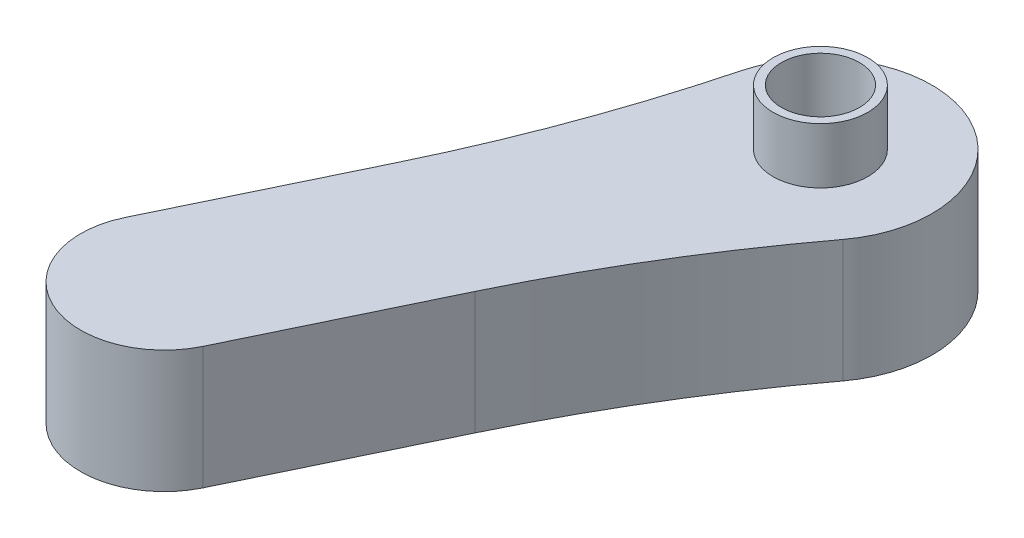
from build123d import *
from build123d.topology import SkipClean

# Parameters (mm, degrees)
EXTRUDE_1_DEPTH     = 4
SKETCH_4_R          = 17
SKETCH_4_R_2        = 14
EXTRUDE_2_DEPTH     = 20
SKETCH_5_R          = 1.75
CUT_EXTRUDE_1_DEPTH = 20
SKETCH_6_R          = 2.4
CUT_EXTRUDE_2_DEPTH = 3
EXTRUDE_START       = 40
EXTRUDE_5_DEPTH     = 40
SKETCH_12_R         = 2.4
CUT_EXTRUDE_3_DEPTH = 3


with BuildPart() as part:
    # 草图1 → 凸台-拉伸1 (new body)
    with BuildSketch(Plane(origin=(0, 0, 0), x_dir=(1, 0, 0), z_dir=(0, 1, 0))):
        with BuildLine():
            Line((-71.917570517, -80.173954941), (-103.604258307, -145.956882654))
            ThreePointArc((-103.604258307, -145.956882654), (-89.595311386, -186.003722806), (-49.548471234, -171.994775885))
            Line((-49.548471234, -171.994775885), (-17.861783444, -106.211848172))
            ThreePointArc((-17.861783444, -106.211848172), (5.107697531, -63.872728225), (32.044674728, -23.940317909))
            ThreePointArc((32.044674728, -23.940317909), (17.358595487, 36.037191382), (-38.694997244, 10.133962122))
            ThreePointArc((-38.694997244, 10.133962122), (-53.128760753, -35.82106595), (-71.917570517, -80.173954941))
        make_face()
    extrude(amount=EXTRUDE_1_DEPTH)

    # 草图4 → 凸台-拉伸2 (add)
    with BuildSketch(Plane(origin=(0, 4, 0), x_dir=(1, 0, 0), z_dir=(0, 1, 0))):
        with Locations(Location((0, 0, 0), (0, 0, 270))):
            Circle(SKETCH_4_R)
        with Locations(Location((0, 0, 0), (0, 0, 270))):
            Circle(SKETCH_4_R_2, mode=Mode.SUBTRACT)
    extrude(amount=EXTRUDE_2_DEPTH)

    # 草图5 → 切除-拉伸1 (cut)
    with BuildSketch(Plane(origin=(0, 4, 0), x_dir=(1, 0, 0), z_dir=(0, 1, 0))):
        with Locations(Location((3.471719097, 7.207438276, 0), (0, 0, 270))):
            Circle(SKETCH_5_R)
        with Locations(Location((7.207438276, -3.471719097, 0), (0, 0, 270))):
            Circle(SKETCH_5_R)
        with Locations(Location((-3.471719097, -7.207438276, 0), (0, 0, 270))):
            Circle(SKETCH_5_R)
        with Locations(Location((-7.207438276, 3.471719097, 0), (0, 0, 270))):
            Circle(SKETCH_5_R)
    extrude(amount=-CUT_EXTRUDE_1_DEPTH, mode=Mode.SUBTRACT)

    # 草图6 → 切除-拉伸2 (cut)
    with BuildSketch(Plane.XZ):
        with Locations(Location((-3.471719097, 7.207438276, 0), (0, 0, 270))):
            Circle(SKETCH_6_R)
        with Locations(Location((7.207438276, 3.471719097, 0), (0, 0, 270))):
            Circle(SKETCH_6_R)
        with Locations(Location((3.471719097, -7.207438276, 0), (0, 0, 270))):
            Circle(SKETCH_6_R)
        with Locations(Location((-7.207438276, -3.471719097, 0), (0, 0, 270))):
            Circle(SKETCH_6_R)
    extrude(amount=-CUT_EXTRUDE_2_DEPTH, mode=Mode.SUBTRACT)

    # 草图11 → 凸台-拉伸5 (add)
    with SkipClean():  # the faces are left unmerged after this step: merging them gives an invalid solid
        with BuildSketch(Plane.XZ.offset(EXTRUDE_START)):
            with BuildLine():
                Line((-103.604258307, 145.956882654), (-71.917570517, 80.173954941))
                ThreePointArc((-71.917570517, 80.173954941), (-53.128760753, 35.82106595), (-38.694997244, -10.133962122))
                ThreePointArc((-38.694997244, -10.133962122), (17.358595487, -36.037191382), (32.044674728, 23.940317909))
                ThreePointArc((32.044674728, 23.940317909), (5.107697531, 63.872728225), (-17.861783444, 106.211848172))
                Line((-17.861783444, 106.211848172), (-49.548471234, 171.994775885))
                ThreePointArc((-49.548471234, 171.994775885), (-89.595311386, 186.003722806), (-103.604258307, 145.956882654))
            make_face()
            with BuildLine():
                Line((-96.745802514, 140.935768818), (-71.568588033, 88.666787874))
                ThreePointArc((-71.568588033, 88.666787874), (-61.544816275, 85.139390897), (-65.109479918, 75.128811353))
                ThreePointArc((-65.109479918, 75.128811353), (-49.374731136, 37.202102387), (-36.779545797, -1.879592541))
                ThreePointArc((-36.779545797, -1.879592541), (-27.687675592, -6.818067672), (-32.179954873, -16.138478998))
                ThreePointArc((-32.179954873, -16.138478998), (-15.10163612, -32.679360252), (8.5634864, -34.966651265))
                ThreePointArc((8.5634864, -34.966651265), (12.367999285, -25.67649886), (22.003915341, -28.492590434))
                ThreePointArc((22.003915341, -28.492590434), (34.967011705, -8.562014508), (32.678724536, 15.10301171))
                ThreePointArc((32.678724536, 15.10301171), (22.590429241, 17.400170493), (24.396227083, 27.587895194))
                ThreePointArc((24.396227083, 27.587895194), (1.68773424, 61.798155716), (-18.160580922, 97.743419068))
                ThreePointArc((-18.160580922, 97.743419068), (-28.210320728, 101.196136769), (-24.720239236, 111.232962008))
                Line((-24.720239236, 111.232962008), (-49.897453718, 163.501942952))
                ThreePointArc((-49.897453718, 163.501942952), (-59.65614547, 166.524138152), (-57.347459227, 176.475806172))
                ThreePointArc((-57.347459227, 176.475806172), (-87.859451837, 182.400003667), (-102.246681086, 154.848498381))
                ThreePointArc((-102.246681086, 154.848498381), (-93.025918977, 150.450399395), (-96.745802514, 140.935768818))
            make_face(mode=Mode.SUBTRACT)
        extrude(amount=-EXTRUDE_5_DEPTH)

    # 草图12 → 切除-拉伸3 (cut)
    with SkipClean():  # the faces are left unmerged after this step: merging them gives an invalid solid
        with BuildSketch(Plane.XZ.offset(40)):
            with Locations(Location((27.568748152, 20.750426991, 0), (0, 0, 270))):
                Circle(SKETCH_12_R)
            with Locations(Location((-22.822392762, 103.836575579, 0), (0, 0, 270))):
                Circle(SKETCH_12_R)
            with Locations(Location((-54.508506622, 169.61828678, 0), (0, 0, 270))):
                Circle(SKETCH_12_R)
            with Locations(Location((14.971788608, -31.082077567, 0), (0, 0, 270))):
                Circle(SKETCH_12_R)
            with Locations(Location((-98.654144553, 148.353969501, 0), (0, 0, 90))):
                Circle(SKETCH_12_R)
            with Locations(Location((-66.96805025, 82.57224888, 0), (0, 0, 90))):
                Circle(SKETCH_12_R)
            with Locations(Location((-33.410617721, -8.62245432, 0), (0, 0, 90))):
                Circle(SKETCH_12_R)
        extrude(amount=-CUT_EXTRUDE_3_DEPTH, mode=Mode.SUBTRACT)


solid = part.part
